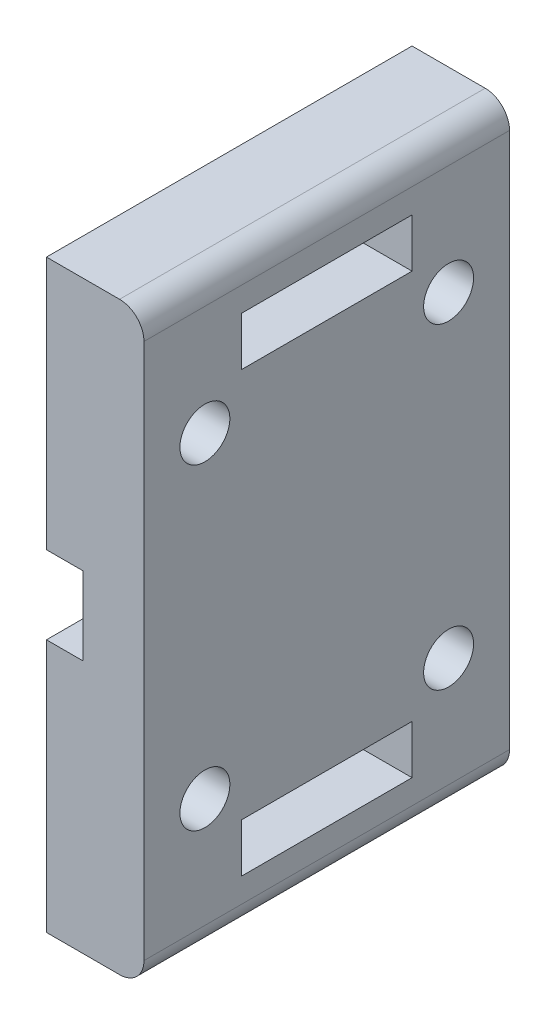
from build123d import *

# Parameters (mm, degrees)
SKETCH1_W                    = 15
SKETCH1_H                    = 24
BOSS_EXTRUDE1_DEPTH          = 4
SKETCH2_R                    = 5.25
CUT_EXTRUDE1_DEPTH           = 1.5
CUT_EXTRUDE2_REACH           = 23.213
CUT_EXTRUDE2_END_RADIUS      = 5.25
SKETCH3_W                    = 1.5
SKETCH3_H                    = 3.2
SKETCH4_R                    = 0.8
CUT_EXTRUDE3_DEPTH           = 1.2
SKETCH5_W                    = 7
SKETCH5_H                    = 2
CUT_EXTRUDE4_DEPTH           = 20.62141687
M2_5X0_45_TAPPED_HOLE1_D     = 2.05
M2_5X0_45_TAPPED_HOLE1_DEPTH = 6.35
M2_5X0_45_TAPPED_HOLE1_TIP   = 0.615882135
FILLET1_R                    = 1


with BuildPart() as part:
    # Sketch1 → Boss-Extrude1 (new body)
    with BuildSketch(Plane(origin=(0, 0, -7.5), x_dir=(0, 0, 1), z_dir=(-1, 0, 0))):
        Rectangle(SKETCH1_W, SKETCH1_H)
    extrude(amount=BOSS_EXTRUDE1_DEPTH)

    # Sketch2 → Cut-Extrude1 (cut)
    with BuildSketch(Plane.ZY.offset(4)):
        with Locations((-7.5, 0)):
            Circle(SKETCH2_R)
    extrude(amount=-CUT_EXTRUDE1_DEPTH, mode=Mode.SUBTRACT)

    # Cut-Extrude2: up to this cylinder (the profile starts outside it)
    cut_extrude2_end = Plane(origin=(-3.25, 0, -7.5), z_dir=(-1, 0, 0)) * Cylinder(CUT_EXTRUDE2_END_RADIUS, 57.926, mode=Mode.PRIVATE)
    # Sketch3 → Cut-Extrude2 (cut, up to the surface)
    with BuildSketch(Plane(origin=(5, 0, 0), x_dir=(1, 0, 0), z_dir=(0, 0, 1)), mode=Mode.PRIVATE) as cut_extrude2_sk1:
        with Locations((-8.25, 0)):
            Rectangle(SKETCH3_W, SKETCH3_H)
    cut_extrude2_tool1 = extrude(cut_extrude2_sk1.sketch, amount=-CUT_EXTRUDE2_REACH, mode=Mode.PRIVATE) - cut_extrude2_end
    add(cut_extrude2_tool1.solids().sort_by_distance((-3.25, 0, 0))[0], mode=Mode.SUBTRACT)

    # Sketch4 → Cut-Extrude3 (cut)
    with BuildSketch(Plane.ZY.offset(2.5)):
        with Locations((-7.5, 0)):
            Circle(SKETCH4_R)
    extrude(amount=-CUT_EXTRUDE3_DEPTH, mode=Mode.SUBTRACT)

    # Sketch5 → Cut-Extrude4 (cut, through all)
    with BuildSketch(Plane.ZY.offset(4)):
        with Locations((-7.5, 9)):
            Rectangle(SKETCH5_W, SKETCH5_H)
        with Locations((-7.5, -9)):
            Rectangle(SKETCH5_W, SKETCH5_H)
    extrude(amount=-CUT_EXTRUDE4_DEPTH, mode=Mode.SUBTRACT)

    # M2.5x0.45 Tapped Hole1
    with Locations(Plane.ZY.offset(4)):
        with Locations((-12.5, -6.5), (-12.5, 6.5), (-2.5, 6.5), (-2.5, -6.5)):
            Hole(M2_5X0_45_TAPPED_HOLE1_D / 2, depth=M2_5X0_45_TAPPED_HOLE1_DEPTH)
            with Locations((0, 0, -(M2_5X0_45_TAPPED_HOLE1_DEPTH + M2_5X0_45_TAPPED_HOLE1_TIP / 2))):  # 118° drill point
                Cone(0, M2_5X0_45_TAPPED_HOLE1_D / 2, M2_5X0_45_TAPPED_HOLE1_TIP, mode=Mode.SUBTRACT)

    # Fillet1
    fillet1_edges = [part.edges().sort_by_distance(p)[0] for p in [
        (0, -12, -7.5),
        (0, 12, -7.5),
    ]]
    fillet(fillet1_edges, radius=FILLET1_R)


solid = part.part
